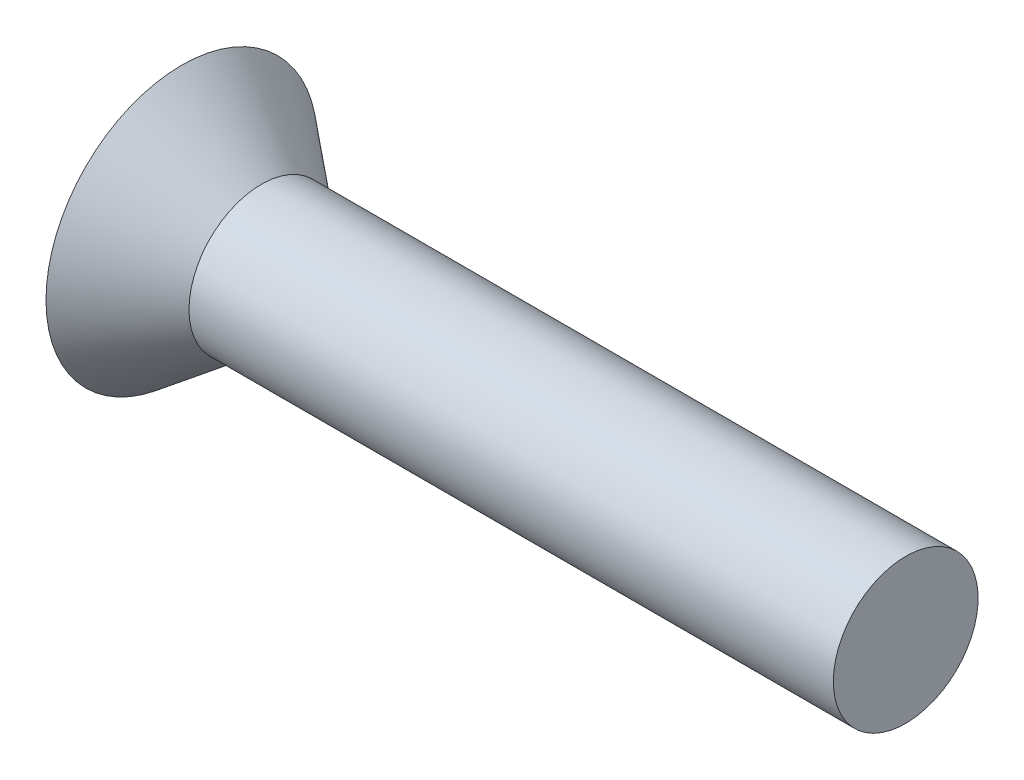
from build123d import *


with BuildPart() as part:
    # Sketch1 → Revolve1 (revolve)
    with BuildSketch(Plane.XY, mode=Mode.PRIVATE) as revolve1_sk:
        Polygon((0, 0), (0, 3.75), (2.2, 2), (20, 2), (20, 0), align=None)
    revolve(revolve1_sk.sketch.rotate(Axis((0, 0, 0), (1, 0, 0)), 90), axis=Axis((0, 0, 0), (1, 0, 0)))


solid = part.part
